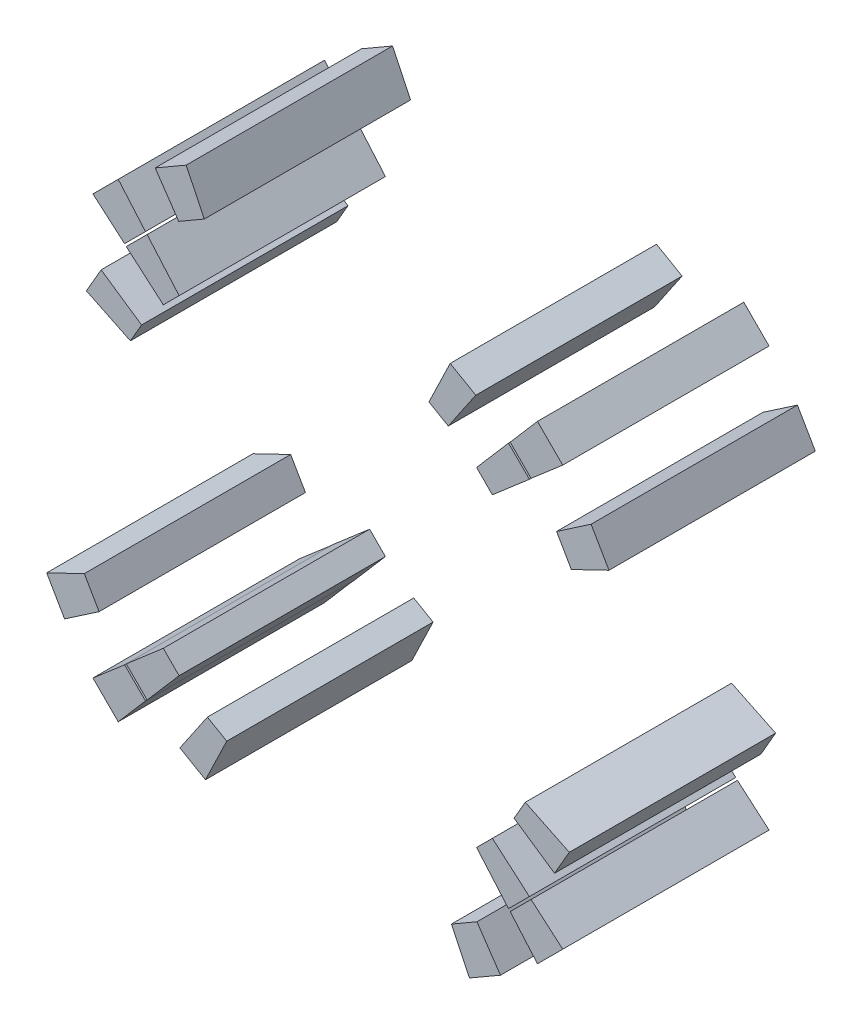
from build123d import *

# Parameters (mm, degrees)
COIL_SIDES_START    = -15
COIL_SIDES_DEPTH    = 30
COIL_SIDES_2_DEPTH  = 30
COIL_SIDES_3_DEPTH  = 30
COIL_SIDES_4_DEPTH  = 30
COIL_SIDES_5_DEPTH  = 30
COIL_SIDES_6_DEPTH  = 30
COIL_SIDES_7_DEPTH  = 30
COIL_SIDES_8_DEPTH  = 30
COIL_SIDES_9_DEPTH  = 30
COIL_SIDES_10_DEPTH = 30
COIL_SIDES_11_DEPTH = 30
COIL_SIDES_12_DEPTH = 30
COIL_SIDES_13_DEPTH = 30
COIL_SIDES_14_DEPTH = 30
COIL_SIDES_15_DEPTH = 30
COIL_SIDES_16_DEPTH = 30


with BuildPart() as part:
    # Эскиз1 → Coil_sides (new body)
    with BuildSketch(Plane.XY.offset(COIL_SIDES_START)):
        Polygon((35.404539789, 17.961307368), (40.877360953, 20.59833395), (38.277360953, 25.10166605), (33.25721836, 21.680577182), align=None)
    extrude(amount=COIL_SIDES_DEPTH)


with BuildPart() as body_2:
    # Эскиз1 → Coil_sides 2 (new body)
    with BuildSketch(Plane.XY.offset(COIL_SIDES_START)):
        Polygon((23.924274918, 21.626177879), (29.307682044, 26.270910957), (26.270910957, 29.307682044), (21.626177879, 23.924274918), align=None)
    extrude(amount=COIL_SIDES_2_DEPTH)


with BuildPart() as body_3:
    # Эскиз1 → Coil_sides 3 (new body)
    with BuildSketch(Plane.XY.offset(COIL_SIDES_START)):
        Polygon((29.549430928, 26.512659841), (34.153257531, 30.476302269), (30.476302269, 34.153257531), (26.512659841, 29.549430928), align=None)
    extrude(amount=COIL_SIDES_3_DEPTH)


with BuildPart() as body_4:
    # Эскиз1 → Coil_sides 4 (new body)
    with BuildSketch(Plane.XY.offset(COIL_SIDES_START)):
        Polygon((17.511808311, 27.081341726), (21.509634907, 32.961137654), (17.790365093, 35.108459083), (14.697225748, 28.706341726), align=None)
    extrude(amount=COIL_SIDES_4_DEPTH)


with BuildPart() as body_5:
    # Эскиз1 → Coil_sides 5 (new body)
    with BuildSketch(Plane.XY.offset(COIL_SIDES_START)):
        Polygon((-17.961307368, 35.404539789), (-20.59833395, 40.877360953), (-25.10166605, 38.277360953), (-21.680577182, 33.25721836), align=None)
    extrude(amount=COIL_SIDES_5_DEPTH)


with BuildPart() as body_6:
    # Эскиз1 → Coil_sides 6 (new body)
    with BuildSketch(Plane.XY.offset(COIL_SIDES_START)):
        Polygon((-21.626177879, 23.924274918), (-26.270910957, 29.307682044), (-29.307682044, 26.270910957), (-23.924274918, 21.626177879), align=None)
    extrude(amount=COIL_SIDES_6_DEPTH)


with BuildPart() as body_7:
    # Эскиз1 → Coil_sides 7 (new body)
    with BuildSketch(Plane.XY.offset(COIL_SIDES_START)):
        Polygon((-26.512659841, 29.549430928), (-30.476302269, 34.153257531), (-34.153257531, 30.476302269), (-29.549430928, 26.512659841), align=None)
    extrude(amount=COIL_SIDES_7_DEPTH)


with BuildPart() as body_8:
    # Эскиз1 → Coil_sides 8 (new body)
    with BuildSketch(Plane.XY.offset(COIL_SIDES_START)):
        Polygon((-27.081341726, 17.511808311), (-32.961137654, 21.509634907), (-35.108459083, 17.790365093), (-28.706341726, 14.697225748), align=None)
    extrude(amount=COIL_SIDES_8_DEPTH)


with BuildPart() as body_9:
    # Эскиз1 → Coil_sides 9 (new body)
    with BuildSketch(Plane.XY.offset(COIL_SIDES_START)):
        Polygon((-35.404539789, -17.961307368), (-40.877360953, -20.59833395), (-38.277360953, -25.10166605), (-33.25721836, -21.680577182), align=None)
    extrude(amount=COIL_SIDES_9_DEPTH)


with BuildPart() as body_10:
    # Эскиз1 → Coil_sides 10 (new body)
    with BuildSketch(Plane.XY.offset(COIL_SIDES_START)):
        Polygon((-23.924274918, -21.626177879), (-29.307682044, -26.270910957), (-26.270910957, -29.307682044), (-21.626177879, -23.924274918), align=None)
    extrude(amount=COIL_SIDES_10_DEPTH)


with BuildPart() as body_11:
    # Эскиз1 → Coil_sides 11 (new body)
    with BuildSketch(Plane.XY.offset(COIL_SIDES_START)):
        Polygon((-29.549430928, -26.512659841), (-34.153257531, -30.476302269), (-30.476302269, -34.153257531), (-26.512659841, -29.549430928), align=None)
    extrude(amount=COIL_SIDES_11_DEPTH)


with BuildPart() as body_12:
    # Эскиз1 → Coil_sides 12 (new body)
    with BuildSketch(Plane.XY.offset(COIL_SIDES_START)):
        Polygon((-17.511808311, -27.081341726), (-21.509634907, -32.961137654), (-17.790365093, -35.108459083), (-14.697225748, -28.706341726), align=None)
    extrude(amount=COIL_SIDES_12_DEPTH)


with BuildPart() as body_13:
    # Эскиз1 → Coil_sides 13 (new body)
    with BuildSketch(Plane.XY.offset(COIL_SIDES_START)):
        Polygon((17.961307368, -35.404539789), (20.59833395, -40.877360953), (25.10166605, -38.277360953), (21.680577182, -33.25721836), align=None)
    extrude(amount=COIL_SIDES_13_DEPTH)


with BuildPart() as body_14:
    # Эскиз1 → Coil_sides 14 (new body)
    with BuildSketch(Plane.XY.offset(COIL_SIDES_START)):
        Polygon((21.626177879, -23.924274918), (26.270910957, -29.307682044), (29.307682044, -26.270910957), (23.924274918, -21.626177879), align=None)
    extrude(amount=COIL_SIDES_14_DEPTH)


with BuildPart() as body_15:
    # Эскиз1 → Coil_sides 15 (new body)
    with BuildSketch(Plane.XY.offset(COIL_SIDES_START)):
        Polygon((26.512659841, -29.549430928), (30.476302269, -34.153257531), (34.153257531, -30.476302269), (29.549430928, -26.512659841), align=None)
    extrude(amount=COIL_SIDES_15_DEPTH)


with BuildPart() as body_16:
    # Эскиз1 → Coil_sides 16 (new body)
    with BuildSketch(Plane.XY.offset(COIL_SIDES_START)):
        Polygon((27.081341726, -17.511808311), (32.961137654, -21.509634907), (35.108459083, -17.790365093), (28.706341726, -14.697225748), align=None)
    extrude(amount=COIL_SIDES_16_DEPTH)


solid = Compound([part.part, body_2.part, body_3.part, body_4.part, body_5.part, body_6.part, body_7.part, body_8.part, body_9.part, body_10.part, body_11.part, body_12.part, body_13.part, body_14.part, body_15.part, body_16.part])
